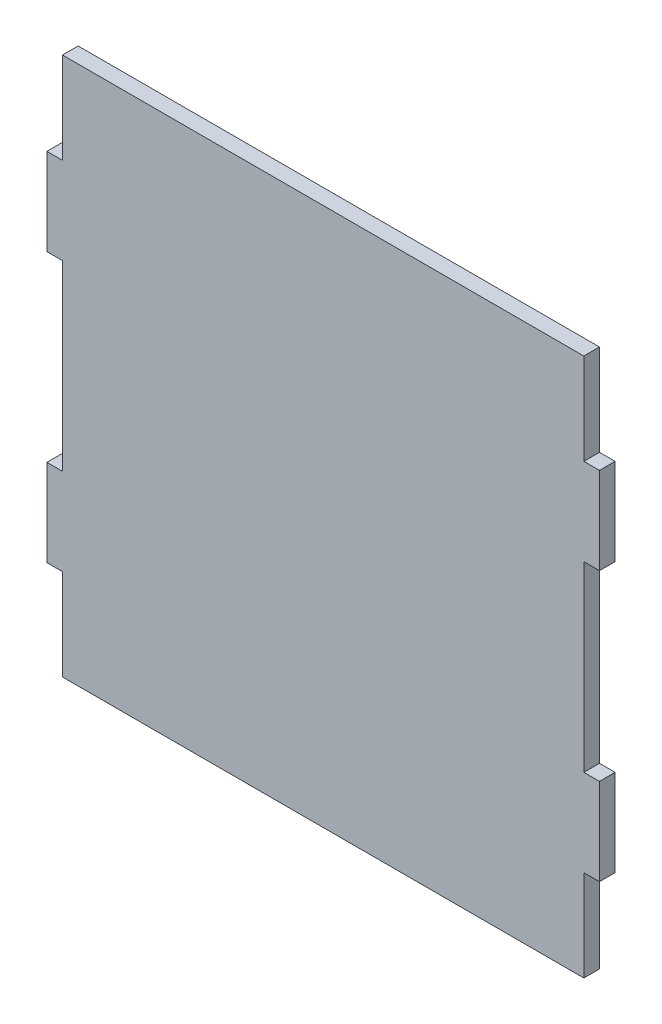
from build123d import *

# Parameters (mm, degrees)
BOSS_EXTRUDE3_DEPTH = 18


with BuildPart() as part:
    # Sketch1 → Boss-Extrude3 (new body)
    with BuildSketch(Plane.XY):
        Polygon((0, 0), (0, -105), (-18, -105), (-18, -205), (0, -205), (0, -415), (-18, -415), (-18, -515), (0, -515), (0, -620), (600, -620), (600, -515), (618, -515), (618, -415), (600, -415), (600, -205), (618, -205), (618, -105), (600, -105), (600, 0), align=None)
    extrude(amount=BOSS_EXTRUDE3_DEPTH)


solid = part.part
